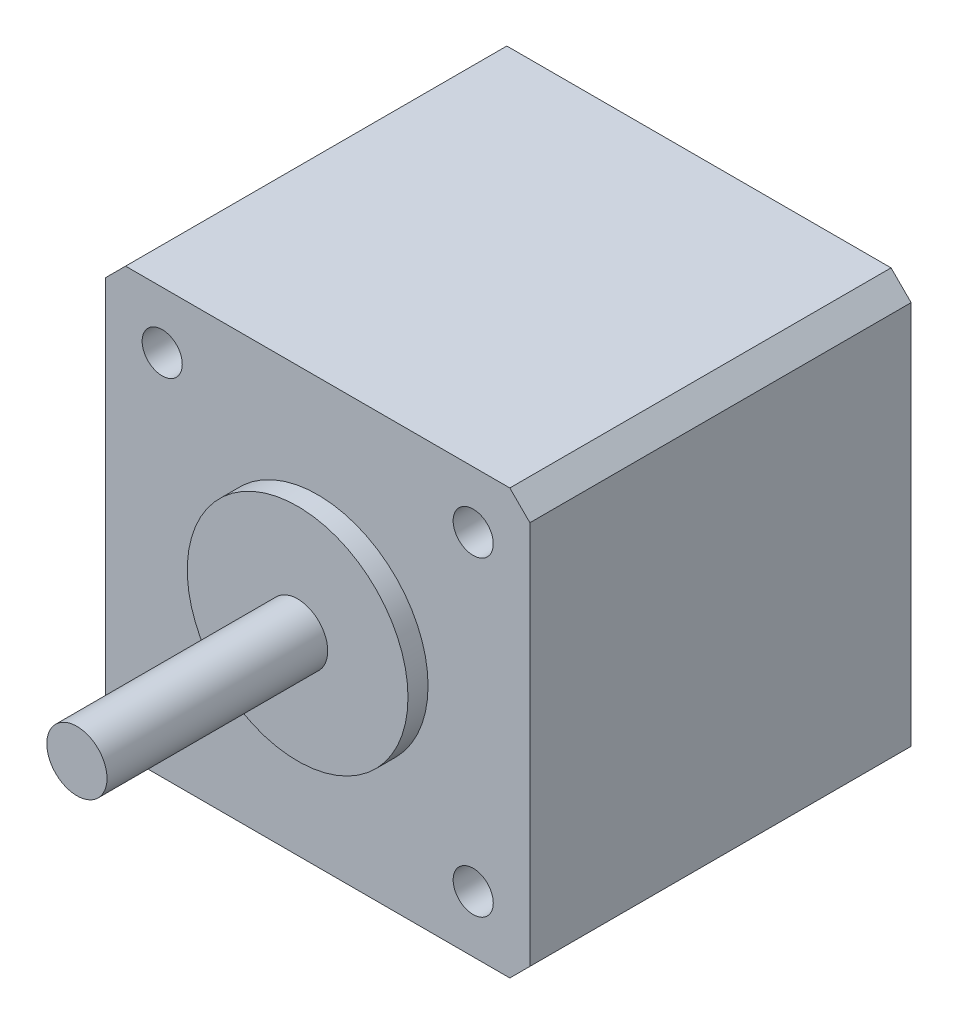
from build123d import *

# Parameters (mm, degrees)
ESQUISSE1_R              = 2
BASE_RECTANGULAIRE_DEPTH = 38
ESQUISSE2_R              = 11
BOSS_DISQUE_DEPTH        = 2
ESQUISSE3_R              = 3
BOSS_AXE_DEPTH           = 22


with BuildPart() as part:
    # Esquisse1 → BASE RECTANGULAIRE (new body)
    with BuildSketch(Plane.XY):
        Polygon((-19.15, -21.15), (19.15, -21.15), (21.15, -19.15), (21.15, 19.15), (19.15, 21.15), (-19.15, 21.15), (-21.15, 19.15), (-21.15, -19.15), align=None)
        with Locations((-15.5, 15.5)):
            Circle(ESQUISSE1_R, mode=Mode.SUBTRACT)
        with Locations(Location((15.5, 15.5, 0), (0, 0, 180))):
            Circle(ESQUISSE1_R, mode=Mode.SUBTRACT)
        with Locations((15.5, -15.5)):
            Circle(ESQUISSE1_R, mode=Mode.SUBTRACT)
        with Locations(Location((-15.5, -15.5, 0), (0, 0, 180))):
            Circle(ESQUISSE1_R, mode=Mode.SUBTRACT)
    extrude(amount=BASE_RECTANGULAIRE_DEPTH)

    # Esquisse2 → BOSS DISQUE (add)
    with BuildSketch(Plane.XY.offset(38)):
        Circle(ESQUISSE2_R)
    extrude(amount=BOSS_DISQUE_DEPTH)

    # Esquisse3 → BOSS AXE (add)
    with BuildSketch(Plane.XY.offset(40)):
        Circle(ESQUISSE3_R)
    extrude(amount=BOSS_AXE_DEPTH)


solid = part.part
